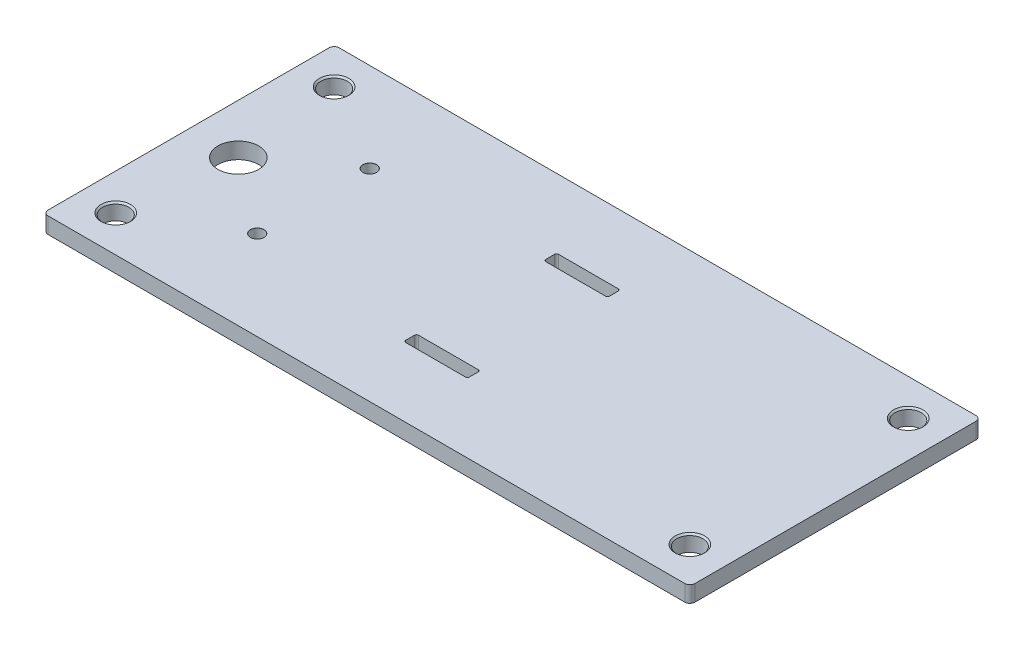
from build123d import *

# Parameters (mm, degrees)
SKETCH1_W                         = 254
SKETCH1_H                         = 114.3
BOSS_EXTRUDE1_DEPTH               = 6.35
FILLET1_R                         = 2
SKETCH6_W                         = 25
SKETCH6_H                         = 5
CUT_EXTRUDE1_DEPTH                = 140.411064841
FILLET2_R                         = 0.75
F_3_8_CLEARANCE_HOLE1_D           = 10.31748
F_3_8_CLEARANCE_HOLE1_CSINK_D     = 11.58748
F_3_8_CLEARANCE_HOLE1_CSINK_ANGLE = 90
SKETCH10_R                        = 8
CUT_EXTRUDE2_DEPTH                = 140.411064841
M3_CLEARANCE_HOLE1_D              = 5.3
M3_CLEARANCE_HOLE1_CSINK_D        = 5.35
M3_CLEARANCE_HOLE1_CSINK_ANGLE    = 90


with BuildPart() as part:
    # Sketch1 → Boss-Extrude1 (new body)
    with BuildSketch(Plane(origin=(0, 0, 0), x_dir=(1, 0, 0), z_dir=(0, 1, 0))):
        Rectangle(SKETCH1_W, SKETCH1_H)
    extrude(amount=BOSS_EXTRUDE1_DEPTH)

    # Fillet1
    fillet1_edges = [part.edges().sort_by_distance(p)[0] for p in [
        (127, 3.175, 57.15),
        (-127, 3.175, 57.15),
        (-127, 3.175, -57.15),
        (127, 3.175, -57.15),
    ]]
    fillet(fillet1_edges, radius=FILLET1_R)

    # Sketch6 → Cut-Extrude1 (cut, through all)
    with BuildSketch(Plane(origin=(0, 6.35, 0), x_dir=(1, 0, 0), z_dir=(0, 1, 0))):
        with Locations((0, 27.5)):
            Rectangle(SKETCH6_W, SKETCH6_H)
        with Locations((0, -27.5)):
            Rectangle(SKETCH6_W, SKETCH6_H)
    extrude(amount=-CUT_EXTRUDE1_DEPTH, mode=Mode.SUBTRACT)

    # Fillet2
    fillet2_edges = [part.edges().sort_by_distance(p)[0] for p in [
        (12.5, 3.175, 25),
        (12.5, 3.175, 30),
        (-12.5, 3.175, 30),
        (-12.5, 3.175, 25),
        (12.5, 3.175, -25),
        (-12.5, 3.175, -25),
        (-12.5, 3.175, -30),
        (12.5, 3.175, -30),
    ]]
    fillet(fillet2_edges, radius=FILLET2_R)

    # 3/8 Clearance Hole1 (through all)
    with Locations(Plane(origin=(0, 6.35, 0), x_dir=(1, 0, 0), z_dir=(0, 1, 0))):
        with Locations((112.7125, 42.8625), (112.7125, -42.8675), (-112.7175, 42.8625), (-112.7175, -42.8675)):
            CounterSinkHole(F_3_8_CLEARANCE_HOLE1_D / 2, F_3_8_CLEARANCE_HOLE1_CSINK_D / 2, counter_sink_angle=F_3_8_CLEARANCE_HOLE1_CSINK_ANGLE)

    # Sketch10 → Cut-Extrude2 (cut, through all)
    with BuildSketch(Plane(origin=(0, 6.35, 0), x_dir=(1, 0, 0), z_dir=(0, 1, 0))):
        with Locations(Location((-107.475, 0, 0), (0, 0, 270))):
            Circle(SKETCH10_R)
    extrude(amount=-CUT_EXTRUDE2_DEPTH, mode=Mode.SUBTRACT)

    # M3 Clearance Hole1 (through all)
    with Locations(Plane(origin=(0, 6.35, 0), x_dir=(1, 0, 0), z_dir=(0, 1, 0))):
        with Locations((-77.95, 22.1), (-77.95, -22.1)):
            CounterSinkHole(M3_CLEARANCE_HOLE1_D / 2, M3_CLEARANCE_HOLE1_CSINK_D / 2, counter_sink_angle=M3_CLEARANCE_HOLE1_CSINK_ANGLE)


solid = part.part
